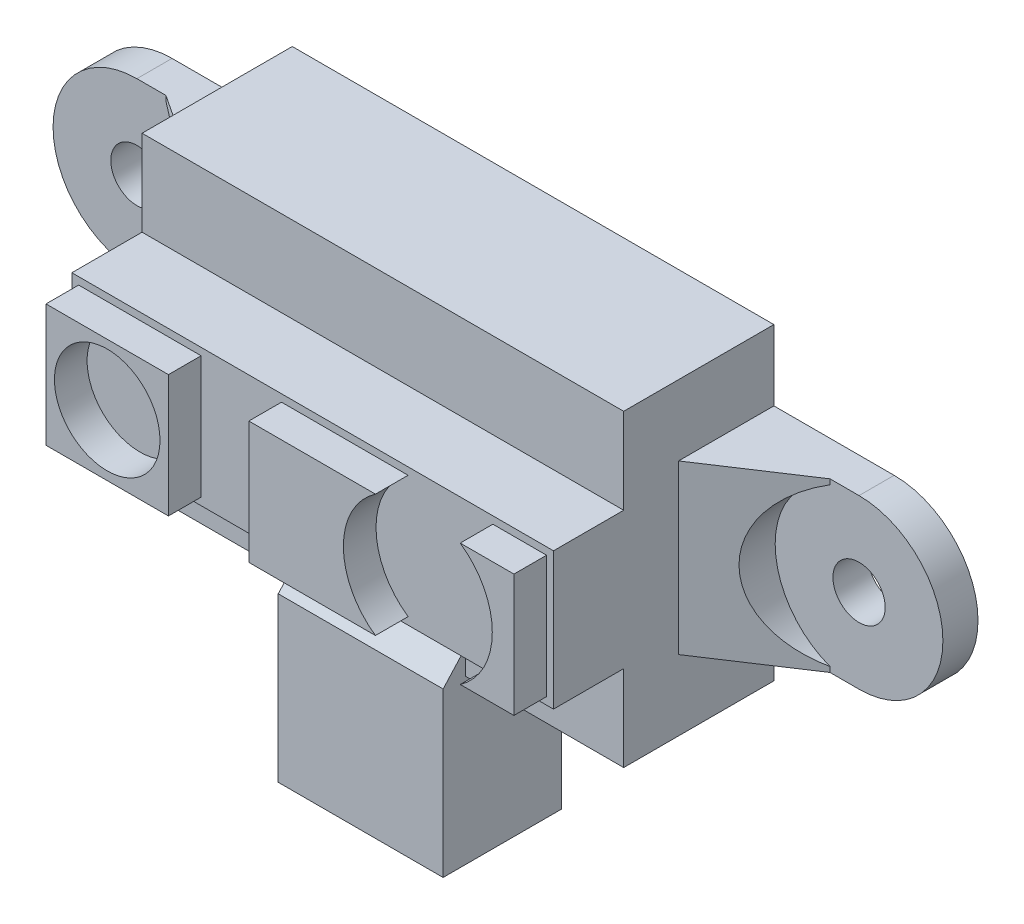
from build123d import *

# Parameters (mm, degrees)
SKETCH1_R           = 1.6
BOSS_EXTRUDE1_DEPTH = 13.5
CUT_EXTRUDE2_DEPTH  = 54.452572483
SKETCH3_W           = 4.3
SKETCH3_H           = 5.25
CUT_EXTRUDE4_DEPTH  = 54.452572483
SKETCH4_W           = 7.5
SKETCH4_H           = 7.5
SKETCH4_R           = 3.233378309
BOSS_EXTRUDE2_DEPTH = 2
CUT_EXTRUDE6_START  = -7.05
SKETCH5_R           = 5.136449747
CUT_EXTRUDE6_DEPTH  = 7.05
SKETCH6_W           = 10.1
SKETCH6_H           = 7.260831794
BOSS_EXTRUDE3_DEPTH = 10
BOSS_EXTRUDE4_DEPTH = 10.1


with BuildPart() as part:
    # Sketch1 → Boss-Extrude1 (new body)
    with BuildSketch(Plane.XY):
        with BuildLine():
            Line((6.026068185, 19.19002712), (35.526068185, 19.19002712))
            Line((35.526068185, 19.19002712), (35.526068185, 14.876476867))
            Line((35.526068185, 14.876476867), (42.891358492, 14.876476867))
            ThreePointArc((42.891358492, 14.876476867), (48.027808239, 9.74002712), (42.891358492, 4.603577373))
            Line((42.891358492, 4.603577373), (35.526068185, 4.603577373))
            Line((35.526068185, 4.603577373), (35.526068185, 0.29002712))
            Line((35.526068185, 0.29002712), (6.026068185, 0.29002712))
            Line((6.026068185, 0.29002712), (6.026068185, 4.603577373))
            Line((6.026068185, 4.603577373), (-1.339222121, 4.603577373))
            ThreePointArc((-1.339222121, 4.603577373), (-6.475671868, 9.74002712), (-1.339222121, 14.876476867))
            Line((-1.339222121, 14.876476867), (6.026068185, 14.876476867))
            Line((6.026068185, 14.876476867), (6.026068185, 19.19002712))
        make_face()
        with Locations((-1.339222121, 9.74002712)):
            Circle(SKETCH1_R, mode=Mode.SUBTRACT)
        with Locations((42.891358492, 9.74002712)):
            Circle(SKETCH1_R, mode=Mode.SUBTRACT)
    extrude(amount=BOSS_EXTRUDE1_DEPTH)

    # Sketch2 → Cut-Extrude2 (cut, through all)
    with BuildSketch(Plane(origin=(0, 0, 0), x_dir=(1, 0, 0), z_dir=(0, 1, 0))):
        Polygon((-6.475671868, -2.15), (-6.475671868, 0), (-10.044911126, 0), (-10.044911126, -17.049735049), (6.026068185, -17.049735049), (6.026068185, -5.837365249), (0.437350873, -2.15), align=None)
        Polygon((48.027808239, 0), (51.597047497, 0), (51.597047497, -17.049735049), (35.526068185, -17.049735049), (35.526068185, -5.837365249), (41.114785497, -2.15), (48.027808239, -2.15), align=None)
    extrude(amount=CUT_EXTRUDE2_DEPTH, mode=Mode.SUBTRACT)

    # Sketch3 → Cut-Extrude4 (cut, through all)
    with BuildSketch(Plane(origin=(0, 0, 0), x_dir=(0, 0, -1), z_dir=(1, 0, 0))):
        with Locations((-11.35, 16.56502712)):
            Rectangle(SKETCH3_W, SKETCH3_H)
        with Locations((-11.35, 2.91502712)):
            Rectangle(SKETCH3_W, SKETCH3_H)
    extrude(amount=CUT_EXTRUDE4_DEPTH, mode=Mode.SUBTRACT)

    # Sketch4 → Boss-Extrude2 (add)
    # profile 1 of 3: a face of its own
    with BuildSketch(Plane.XY.offset(13.5)):
        with Locations((10.1915125, 9.743497044)):
            Rectangle(SKETCH4_W, SKETCH4_H)
        with Locations((10.1915125, 9.743497044)):
            Circle(SKETCH4_R, mode=Mode.SUBTRACT)
    # profile 2 of 3: a face of its own
    with BuildSketch(Plane.XY.offset(13.5)):
        with BuildLine():
            Line((35.102590636, 13.493497044), (31.813216882, 13.493497044))
            ThreePointArc((31.813216882, 13.493497044), (33.77792813, 9.743497044), (31.813216882, 5.993497044))
            Line((31.813216882, 5.993497044), (35.102590636, 5.993497044))
            Line((35.102590636, 5.993497044), (35.102590636, 13.493497044))
        make_face()
    # profile 3 of 3: a face of its own
    with BuildSketch(Plane.XY.offset(13.5)):
        with BuildLine():
            Line((18.865933267, 13.493497044), (18.865933267, 5.993497044))
            Line((18.865933267, 5.993497044), (26.620387797, 5.993497044))
            ThreePointArc((26.620387797, 5.993497044), (24.655676549, 9.743497044), (26.620387797, 13.493497044))
            Line((26.620387797, 13.493497044), (18.865933267, 13.493497044))
        make_face()
    extrude(amount=BOSS_EXTRUDE2_DEPTH)

    # Sketch5 → Cut-Extrude6 (cut)
    with BuildSketch(Plane.XY.offset(9.2).offset(CUT_EXTRUDE6_START)):
        with Locations((-1.339222121, 9.74002712)):
            Circle(SKETCH5_R)
        with Locations((42.891358492, 9.74002712)):
            Circle(SKETCH5_R)
    extrude(amount=CUT_EXTRUDE6_DEPTH, mode=Mode.SUBTRACT)

    # Sketch6 → Boss-Extrude3 (add)
    with BuildSketch(Plane.XZ.offset(-0.29002712)):
        with Locations((20.776068185, 6.930415897)):
            Rectangle(SKETCH6_W, SKETCH6_H)
    extrude(amount=BOSS_EXTRUDE3_DEPTH)

    # Sketch7 → Boss-Extrude4 (add)
    with BuildSketch(Plane(origin=(25.826068185, 0, 0), x_dir=(0, 0, -1), z_dir=(1, 0, 0))):
        Polygon((-10.560831794, 0.29002712), (-9.2, 0.29002712), (-9.2, 1.787728589), align=None)
    extrude(amount=-BOSS_EXTRUDE4_DEPTH)


solid = part.part
